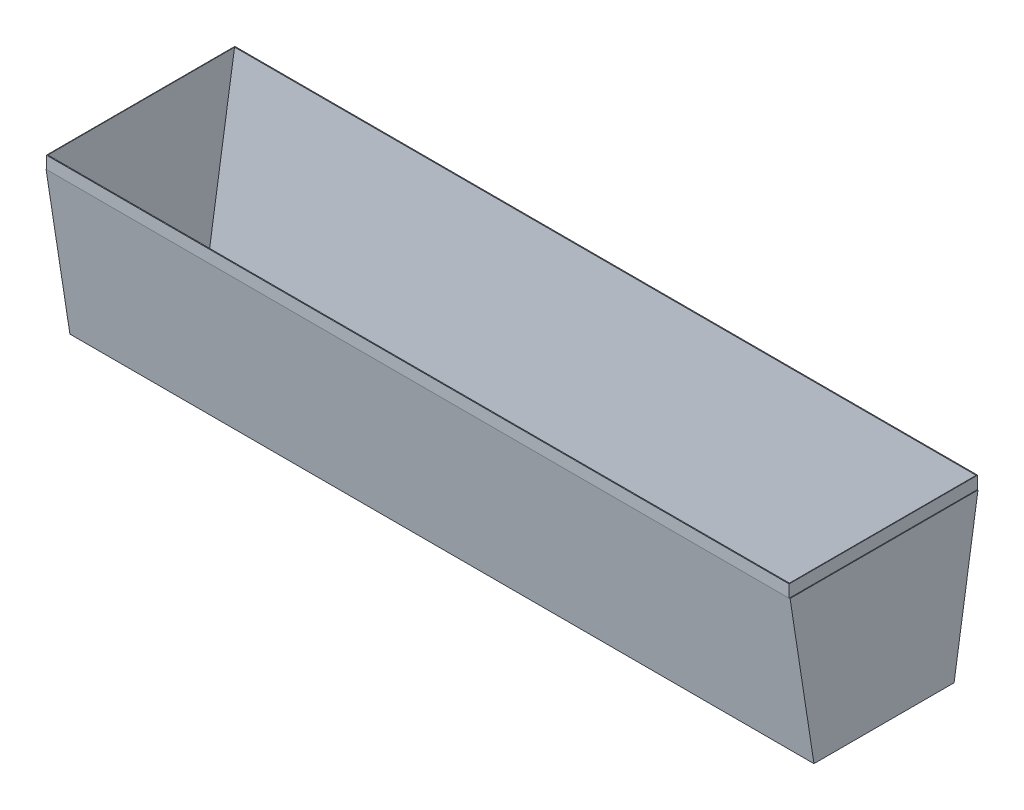
from build123d import *

# Parameters (mm, degrees)
BOSS_EXTRUDE1_DEPTH = 300
SKETCH2_W           = 616.91666666
SKETCH2_H           = 169.999999994
BOSS_EXTRUDE2_DEPTH = 5
CUT_EXTRUDE1_START  = -300
CUT_EXTRUDE1_DEPTH  = 299
SKETCH4_W           = 616.91666666
SKETCH4_H           = 10
CUT_EXTRUDE2_DEPTH  = 9
SKETCH5_W           = 616.91666666
SKETCH5_H           = 10
CUT_EXTRUDE3_DEPTH  = 9
SKETCH6_W           = 151.999999994
SKETCH6_H           = 10
CUT_EXTRUDE4_DEPTH  = 9
SKETCH7_W           = 151.999999994
SKETCH7_H           = 10
CUT_EXTRUDE5_DEPTH  = 9


with BuildPart() as part:
    # Sketch1 → Boss-Extrude1 (new, symmetric)
    with BuildSketch(Plane(origin=(0, 0, 0), x_dir=(0, 0, -1), z_dir=(1, 0, 0))):
        Polygon((0, 0), (113, 0), (133.041666667, 130), (-20.041666667, 130), align=None)
    extrude(amount=BOSS_EXTRUDE1_DEPTH, both=True)

    # Sketch2 → Boss-Extrude2 (add, symmetric)
    with BuildSketch(Plane(origin=(0, 130, 0), x_dir=(1, 0, 0), z_dir=(0, 1, 0))):
        with Locations((0, 56.5)):
            Rectangle(SKETCH2_W, SKETCH2_H)
    extrude(amount=BOSS_EXTRUDE2_DEPTH, both=True)

    # Sketch3 → Cut-Extrude1 (cut, symmetric)
    with BuildSketch(Plane.ZY.offset(300).offset(CUT_EXTRUDE1_START)):
        Polygon((-131.788872207, 135), (18.788872207, 135), (-1.71529446, 2), (-111.28470554, 2), align=None)
    extrude(amount=CUT_EXTRUDE1_DEPTH, both=True, mode=Mode.SUBTRACT)

    # Sketch4 → Cut-Extrude2 (cut)
    with BuildSketch(Plane(origin=(0, 0, -141.499999997), x_dir=(-1, 0, 0), z_dir=(0, 0, -1))):
        with Locations((0, 130)):
            Rectangle(SKETCH4_W, SKETCH4_H)
    extrude(amount=-CUT_EXTRUDE2_DEPTH, mode=Mode.SUBTRACT)

    # Sketch5 → Cut-Extrude3 (cut)
    with BuildSketch(Plane.XY.offset(28.499999997)):
        with Locations((0, 130)):
            Rectangle(SKETCH5_W, SKETCH5_H)
    extrude(amount=-CUT_EXTRUDE3_DEPTH, mode=Mode.SUBTRACT)

    # Sketch6 → Cut-Extrude4 (cut)
    with BuildSketch(Plane.ZY.offset(308.45833333)):
        with Locations((-56.5, 130)):
            Rectangle(SKETCH6_W, SKETCH6_H)
    extrude(amount=-CUT_EXTRUDE4_DEPTH, mode=Mode.SUBTRACT)

    # Sketch7 → Cut-Extrude5 (cut)
    with BuildSketch(Plane(origin=(308.45833333, 0, 0), x_dir=(0, 0, -1), z_dir=(1, 0, 0))):
        with Locations((56.5, 130)):
            Rectangle(SKETCH7_W, SKETCH7_H)
    extrude(amount=-CUT_EXTRUDE5_DEPTH, mode=Mode.SUBTRACT)


solid = part.part
